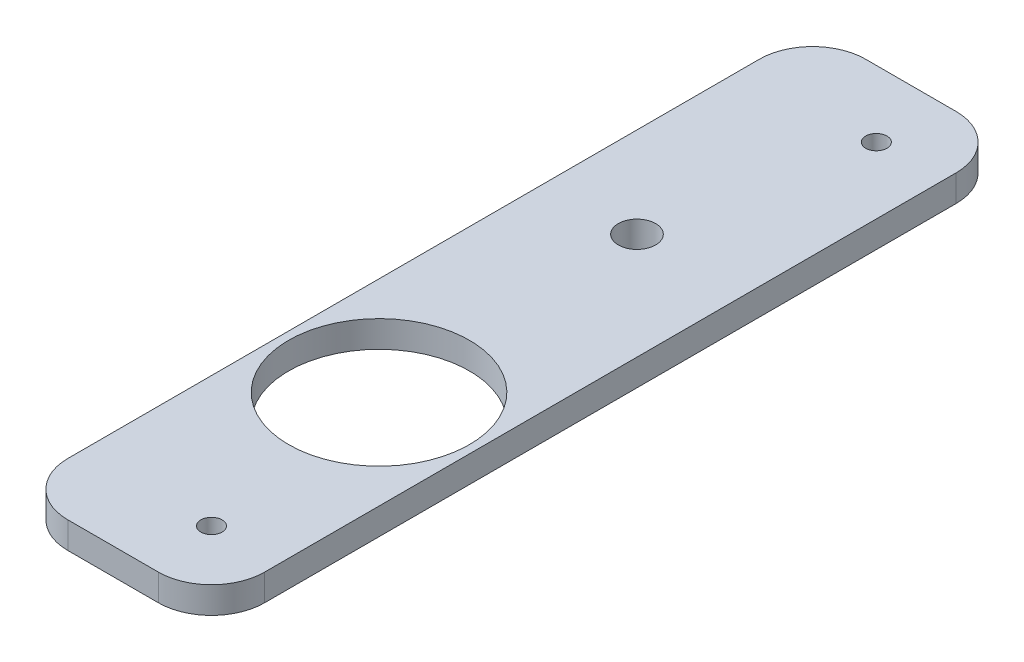
from build123d import *

# Parameters (mm, degrees)
CROQUIS1_W              = 37
CROQUIS1_H              = 150
CROQUIS1_R              = 3.5
CROQUIS1_R_2            = 17
SALIENTE_EXTRUIR1_DEPTH = 5
REDONDEO1_R             = 10
CROQUIS2_R              = 2
CORTAR_EXTRUIR2_DEPTH   = 10


with BuildPart() as part:
    # Croquis1 → Saliente-Extruir1 (new body)
    with BuildSketch(Plane(origin=(0, 0, 0), x_dir=(1, 0, 0), z_dir=(0, 1, 0))):
        Rectangle(CROQUIS1_W, CROQUIS1_H)
        with Locations(Location((-1.5, 25, 0), (0, 0, 270))):
            Circle(CROQUIS1_R, mode=Mode.SUBTRACT)
        with Locations(Location((0, -25, 0), (0, 0, 270))):
            Circle(CROQUIS1_R_2, mode=Mode.SUBTRACT)
    extrude(amount=SALIENTE_EXTRUIR1_DEPTH)

    # Redondeo1
    redondeo1_edges = [part.edges().sort_by_distance(p)[0] for p in [
        (18.5, 2.5, 75),
        (-18.5, 2.5, 75),
        (-18.5, 2.5, -75),
        (18.5, 2.5, -75),
    ]]
    fillet(redondeo1_edges, radius=REDONDEO1_R)

    # Croquis2 → Cortar-Extruir2 (cut)
    with BuildSketch(Plane(origin=(0, 5, 0), x_dir=(1, 0, 0), z_dir=(0, 1, 0))):
        with Locations(Location((6, 62.5, 0), (0, 0, 270))):
            Circle(CROQUIS2_R)
        with Locations(Location((6, -62.5, 0), (0, 0, 270))):
            Circle(CROQUIS2_R)
    extrude(amount=-CORTAR_EXTRUIR2_DEPTH, mode=Mode.SUBTRACT)


solid = part.part
